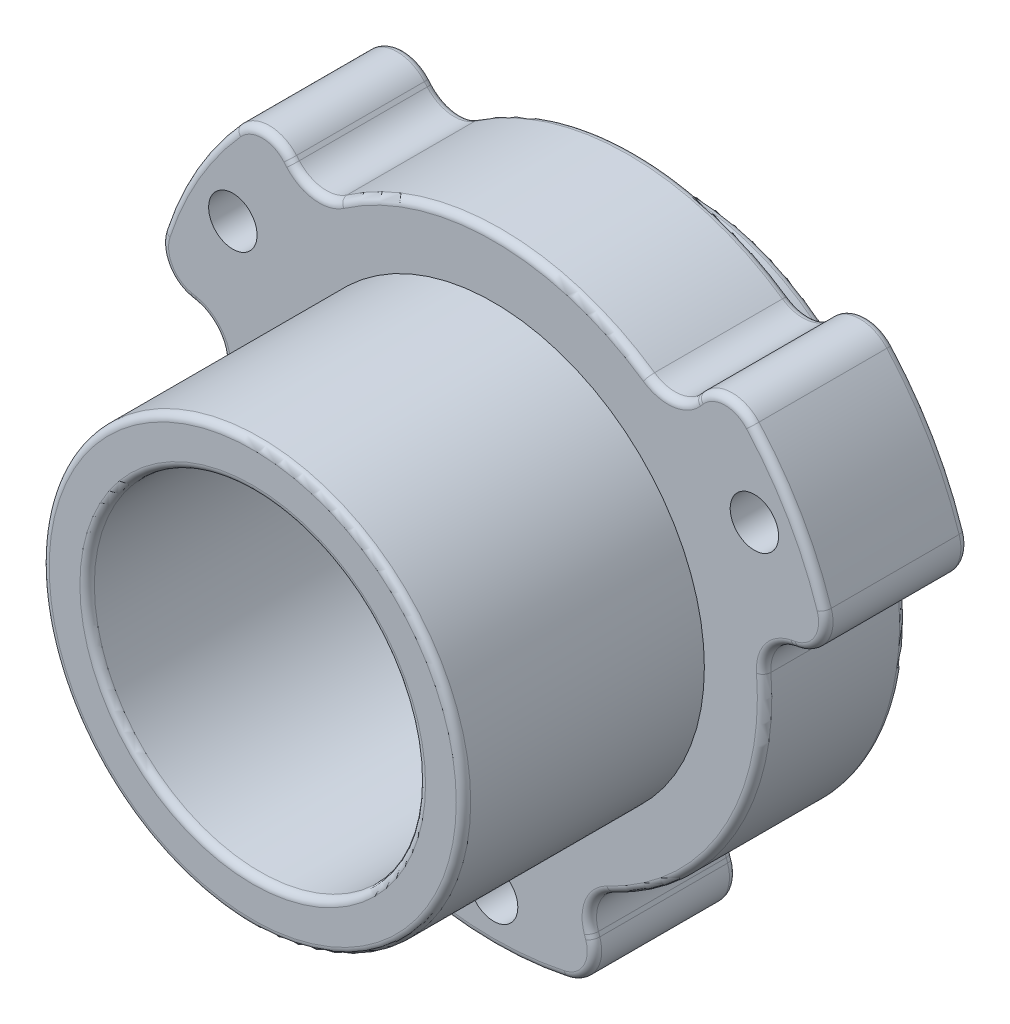
from build123d import *

# Parameters (mm, degrees)
SKETCH2_R               = 36.6395
BOSS_EXTRUDE1_DEPTH     = 15
SKETCH3_R               = 22.225
BOSS_EXTRUDE2_DEPTH     = 5.715
BOSS_EXTRUDE3_START     = 25.4
SKETCH6_R               = 22.225
BOSS_EXTRUDE3_DEPTH     = 25.4
SKETCH5_R               = 17.4625
CUT_EXTRUDE1_DEPTH      = 70.364970594
F_1_4_20_TAPPED_HOLE1_D = 5.1054
CUT_EXTRUDE2_DEPTH      = 58.706723356
FILLET1_R               = 3.81
FILLET2_R               = 0.762


with BuildPart() as part:
    # Sketch2 → Boss-Extrude1 (new body)
    with BuildSketch(Plane.XY):
        Circle(SKETCH2_R)
    extrude(amount=BOSS_EXTRUDE1_DEPTH)

    # Sketch3 → Boss-Extrude2 (add)
    with BuildSketch(Plane.XY):
        Circle(SKETCH3_R)
    extrude(amount=-BOSS_EXTRUDE2_DEPTH)

    # Sketch6 → Boss-Extrude3 (add)
    with BuildSketch(Plane.XY.offset(15).offset(BOSS_EXTRUDE3_START)):
        Circle(SKETCH6_R)
    extrude(amount=-BOSS_EXTRUDE3_DEPTH)

    # Sketch5 → Cut-Extrude1 (cut, through all)
    with BuildSketch(Plane(origin=(0, 0, -5.715), x_dir=(-1, 0, 0), z_dir=(0, 0, -1))):
        Circle(SKETCH5_R)
    extrude(amount=-CUT_EXTRUDE1_DEPTH, mode=Mode.SUBTRACT)

    # 1/4-20 Tapped Hole1 (through all)
    with Locations(Plane(origin=(0, 0, 0), x_dir=(-1, 0, 0), z_dir=(0, 0, -1))):
        with Locations((27.49630657, 15.875), (0, -31.75), (-27.49630657, 15.875)):
            Hole(F_1_4_20_TAPPED_HOLE1_D / 2)

    # Sketch10 → Cut-Extrude2 (cut, through all)
    with BuildSketch(Plane.XY.offset(15)):
        with BuildLine():
            Line((-18.873434881, 21.455164432), (-24.199937614, 27.510288616))
            ThreePointArc((-24.199937614, 27.510288616), (0, 36.6395), (24.199937614, 27.510288616))
            Line((24.199937614, 27.510288616), (18.873434881, 21.455164432))
            ThreePointArc((18.873434881, 21.455164432), (0, 28.575), (-18.873434881, 21.455164432))
        make_face()
        with BuildLine():
            Line((28.017434881, 5.617291847), (35.924577614, 7.202616436))
            ThreePointArc((35.924577614, 7.202616436), (31.730737782, -18.31975), (11.72464, -34.712905052))
            Line((11.72464, -34.712905052), (9.144, -27.072456279))
            ThreePointArc((9.144, -27.072456279), (24.746675913, -14.2875), (28.017434881, 5.617291847))
        make_face()
        with BuildLine():
            Line((-9.144, -27.072456279), (-11.72464, -34.712905052))
            ThreePointArc((-11.72464, -34.712905052), (-31.730737782, -18.31975), (-35.924577614, 7.202616436))
            Line((-35.924577614, 7.202616436), (-28.017434881, 5.617291847))
            ThreePointArc((-28.017434881, 5.617291847), (-24.746675913, -14.2875), (-9.144, -27.072456279))
        make_face()
    extrude(amount=-CUT_EXTRUDE2_DEPTH, mode=Mode.SUBTRACT)

    # Fillet1
    fillet1_edges = [part.edges().sort_by_distance(p)[0] for p in [
        (18.873434881, 21.455164432, 7.5),
        (-18.873434881, 21.455164432, 7.5),
        (-24.199937614, 27.510288616, 7.5),
        (24.199937614, 27.510288616, 7.5),
        (9.144, -27.072456279, 7.5),
        (28.017434881, 5.617291847, 7.5),
        (35.924577614, 7.202616436, 7.5),
        (11.72464, -34.712905052, 7.5),
        (-28.017434881, 5.617291847, 7.5),
        (-9.144, -27.072456279, 7.5),
        (-11.72464, -34.712905052, 7.5),
        (-35.924577614, 7.202616436, 7.5),
    ]]
    fillet(fillet1_edges, radius=FILLET1_R)

    # Fillet2
    fillet2_edges = [part.edges().sort_by_distance(p)[0] for p in [
        (0, 28.575, 15),
        (0, 28.575, 0),
        (31.730737782, 18.31975, 0),
        (31.730737782, 18.31975, 15),
        (-21.389156025, 24.315015389, 15),
        (-31.730737782, 18.31975, 15),
        (-31.751999033, 6.366044788, 15),
        (-24.746675913, -14.2875, 15),
        (-10.362843008, -30.681060177, 15),
        (0, -36.6395, 15),
        (10.362843008, -30.681060177, 15),
        (24.746675913, -14.2875, 15),
        (31.751999033, 6.366044788, 15),
        (-10.135290078, -33.998199512, 15),
        (10.135290078, -33.998199512, 15),
        (34.5109495, 8.221681074, 15),
        (-34.5109495, 8.221681074, 15),
        (-24.375659422, 25.776518438, 15),
        (-22.225, 0, 40.4),
        (24.375659422, 25.776518438, 15),
        (-31.730737782, 18.31975, 0),
        (-21.389156025, 24.315015389, 0),
        (31.751999033, 6.366044788, 0),
        (24.746675913, -14.2875, 0),
        (10.362843008, -30.681060177, 0),
        (0, -36.6395, 0),
        (-10.362843008, -30.681060177, 0),
        (-24.746675913, -14.2875, 0),
        (-31.751999033, 6.366044788, 0),
        (-10.135290078, -33.998199512, 0),
        (10.135290078, -33.998199512, 0),
        (34.5109495, 8.221681074, 0),
        (-34.5109495, 8.221681074, 0),
        (-24.375659422, 25.776518438, 0),
        (24.375659422, 25.776518438, 0),
        (18.847695524, 22.882181987, 15),
        (18.847695524, 22.882181987, 0),
        (-18.847695524, 22.882181987, 15),
        (-18.847695524, 22.882181987, 0),
        (-29.240398656, 4.881492134, 15),
        (-29.240398656, 4.881492134, 0),
        (29.240398656, 4.881492134, 15),
        (29.240398656, 4.881492134, 0),
        (-10.392703132, -27.76367412, 15),
        (-10.392703132, -27.76367412, 0),
        (10.392703132, -27.76367412, 15),
        (10.392703132, -27.76367412, 0),
        (17.4625, 0, 40.4),
        (17.4625, 0, -5.715),
        (-22.225, 0, -5.715),
        (21.389156025, 24.315015389, 15),
        (21.389156025, 24.315015389, 0),
    ]]
    fillet(fillet2_edges, radius=FILLET2_R)


solid = part.part
